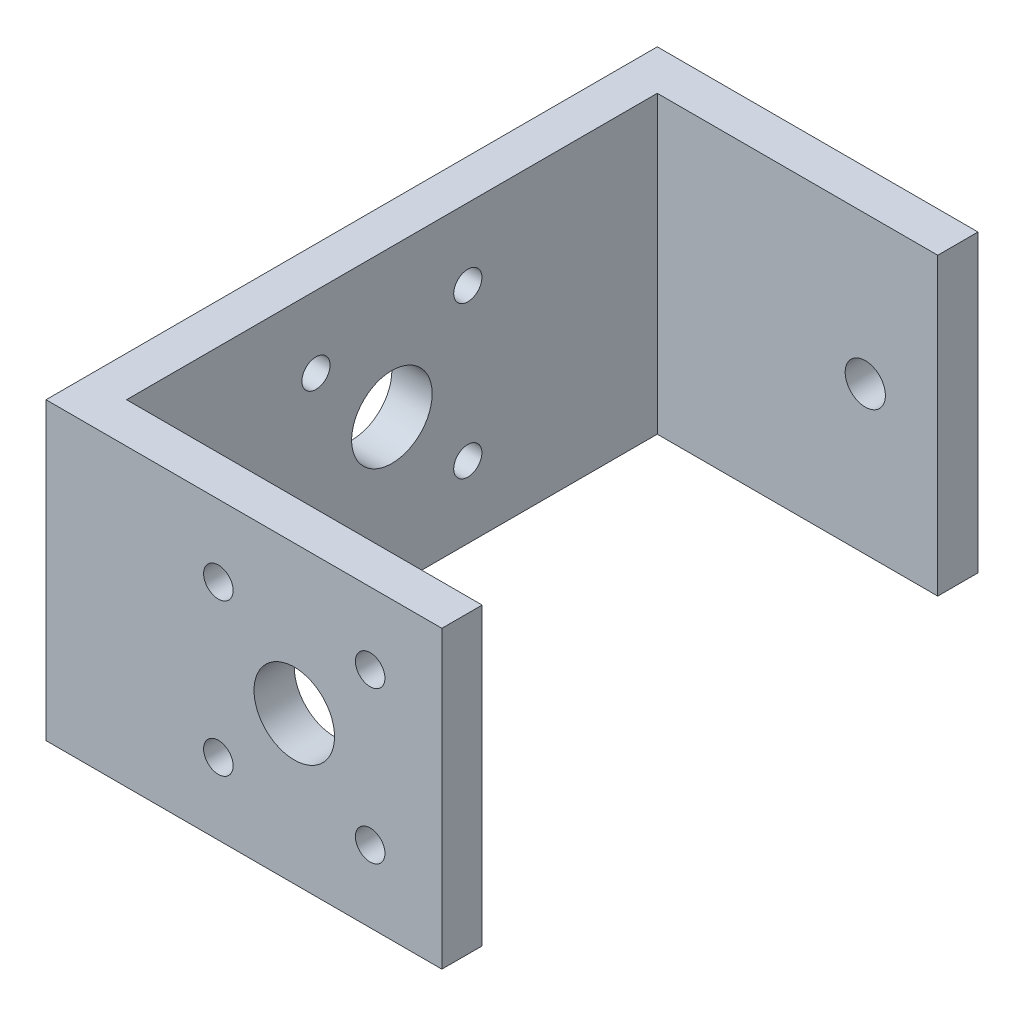
from build123d import *

# Parameters (mm, degrees)
SKETCH1_W           = 39.55
SKETCH1_H           = 22
SKETCH1_R           = 1.05
SKETCH1_R_2         = 3
BOSS_EXTRUDE1_DEPTH = 3
SKETCH1_6_W         = 3
SKETCH1_6_H         = 22
BOSS_EXTRUDE2_DEPTH = 29.5
SKETCH1_7_W         = 3
SKETCH1_7_H         = 22
BOSS_EXTRUDE3_DEPTH = 23.9
SKETCH2_R           = 3
SKETCH2_R_2         = 1.1
CUT_EXTRUDE1_DEPTH  = 3
CIRPATTERN1_COUNT   = 4
SKETCH3_R           = 1.5
CUT_EXTRUDE2_DEPTH  = 3


with BuildPart() as part:
    # Sketch1 → Boss-Extrude1 (new body)
    with BuildSketch(Plane(origin=(0, 0, 0), x_dir=(0, 0, -1), z_dir=(1, 0, 0))):
        Rectangle(SKETCH1_W, SKETCH1_H)
        with Locations((-5.656854249, -5.656854249)):
            Circle(SKETCH1_R, mode=Mode.SUBTRACT)
        with Locations((5.656854249, -5.656854249)):
            Circle(SKETCH1_R, mode=Mode.SUBTRACT)
        with Locations((-5.656854249, 5.656854249)):
            Circle(SKETCH1_R, mode=Mode.SUBTRACT)
        Circle(SKETCH1_R_2, mode=Mode.SUBTRACT)
        with Locations((5.656854249, 5.656854249)):
            Circle(SKETCH1_R, mode=Mode.SUBTRACT)
    extrude(amount=BOSS_EXTRUDE1_DEPTH)

    # Sketch1<6> → Boss-Extrude2 (add)
    with BuildSketch(Plane(origin=(0, 0, 0), x_dir=(0, 0, -1), z_dir=(1, 0, 0))):
        with Locations((-21.275, 0)):
            Rectangle(SKETCH1_6_W, SKETCH1_6_H)
    extrude(amount=BOSS_EXTRUDE2_DEPTH)

    # Sketch1<7> → Boss-Extrude3 (add)
    with BuildSketch(Plane(origin=(0, 0, 0), x_dir=(0, 0, -1), z_dir=(1, 0, 0))):
        with Locations((21.275, 0)):
            Rectangle(SKETCH1_7_W, SKETCH1_7_H)
    extrude(amount=BOSS_EXTRUDE3_DEPTH)

    # Sketch2 → Cut-Extrude1 (cut)
    with BuildSketch(Plane.XY.offset(22.775)):
        with Locations((18.5, 0)):
            Circle(SKETCH2_R)
        with Locations((24.156854249, 5.656854249)):
            Circle(SKETCH2_R_2)
    cut_extrude1 = extrude(amount=-CUT_EXTRUDE1_DEPTH, mode=Mode.SUBTRACT)

    # CirPattern1: Cut-Extrude1 ×4 about axis
    cirpattern1_axis = Axis((18.5, 0, 0), (0, 0, 1))
    for i in range(1, CIRPATTERN1_COUNT):
        add(cut_extrude1.rotate(cirpattern1_axis, i * 360 / CIRPATTERN1_COUNT), mode=Mode.SUBTRACT)

    # Sketch3 → Cut-Extrude2 (cut)
    with BuildSketch(Plane(origin=(0, 0, -22.775), x_dir=(-1, 0, 0), z_dir=(0, 0, -1))):
        with Locations((-18.5, 0)):
            Circle(SKETCH3_R)
    extrude(amount=-CUT_EXTRUDE2_DEPTH, mode=Mode.SUBTRACT)


solid = part.part
